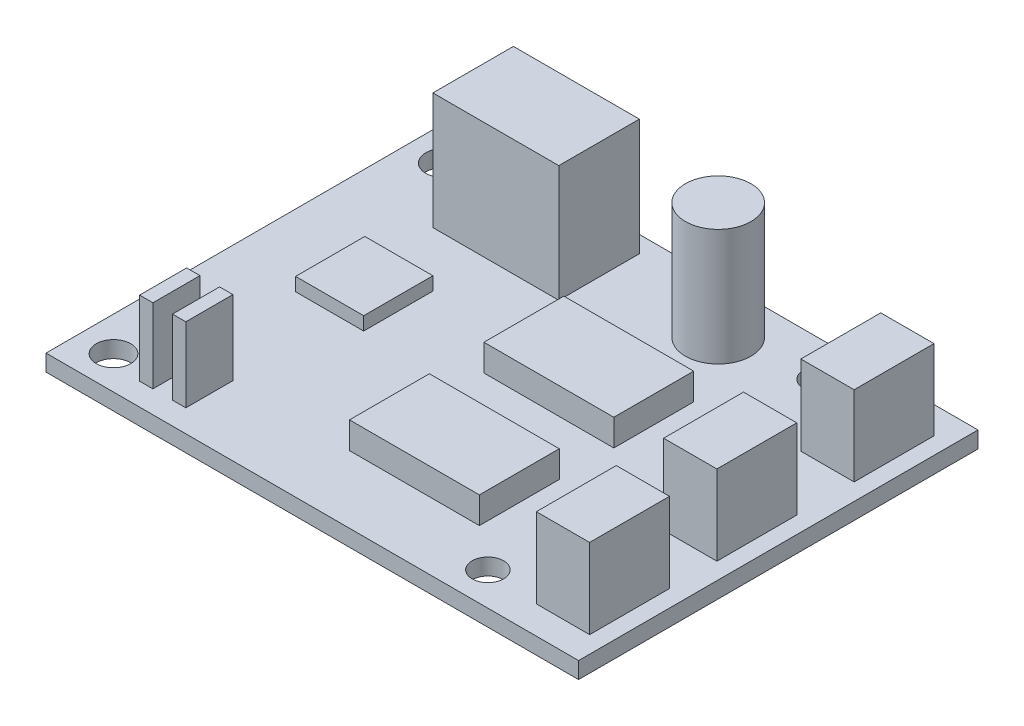
from build123d import *

# Parameters (mm, degrees)
SKETCH1_W           = 50.8
SKETCH1_H           = 38.1
BOSS_EXTRUDE1_DEPTH = 1.5748
SKETCH2_W           = 5.08
SKETCH2_H           = 7.62
BOSS_EXTRUDE2_DEPTH = 7.62
SKETCH3_R           = 3.127542457
SKETCH3_W           = 12.012072663
SKETCH3_H           = 7.683397829
BOSS_EXTRUDE3_DEPTH = 11.1252
SKETCH4_W           = 12.39083171
SKETCH4_H           = 7.62
BOSS_EXTRUDE4_DEPTH = 2.54
SKETCH5_W           = 6.49301225
SKETCH5_H           = 6.601229121
BOSS_EXTRUDE5_DEPTH = 1.27
SKETCH6_W           = 1.27
SKETCH6_H           = 4.49100014
BOSS_EXTRUDE6_DEPTH = 7.112
SKETCH7_R           = 1.645643818
SKETCH7_R_2         = 1.500472866
SKETCH7_R_3         = 1.42952807
SKETCH7_R_4         = 1.703993098
CUT_EXTRUDE1_DEPTH  = 7.112


with BuildPart() as part:
    # Sketch1 → Boss-Extrude1 (new body)
    with BuildSketch(Plane(origin=(0, 0, 0), x_dir=(1, 0, 0), z_dir=(0, 1, 0))):
        with Locations((25.4, 19.05)):
            Rectangle(SKETCH1_W, SKETCH1_H)
    extrude(amount=BOSS_EXTRUDE1_DEPTH)

    # Sketch2 → Boss-Extrude2 (add)
    with BuildSketch(Plane(origin=(0, 1.5748, 0), x_dir=(1, 0, 0), z_dir=(0, 1, 0))):
        with Locations((46.649948662, 6.474433462)):
            Rectangle(SKETCH2_W, SKETCH2_H)
        with Locations((46.649948662, 18.613569988)):
            Rectangle(SKETCH2_W, SKETCH2_H)
        with Locations((46.649948662, 31.703482685)):
            Rectangle(SKETCH2_W, SKETCH2_H)
    extrude(amount=BOSS_EXTRUDE2_DEPTH)

    # Sketch3 → Boss-Extrude3 (add)
    with BuildSketch(Plane(origin=(0, 1.5748, 0), x_dir=(1, 0, 0), z_dir=(0, 1, 0))):
        with Locations(Location((30.756735106, 33.361681168, 0), (0, 0, 90))):
            Circle(SKETCH3_R)
        with Locations((14.091336998, 32.658271508)):
            Rectangle(SKETCH3_W, SKETCH3_H)
    extrude(amount=BOSS_EXTRUDE3_DEPTH)

    # Sketch4 → Boss-Extrude4 (add)
    with BuildSketch(Plane(origin=(0, 1.5748, 0), x_dir=(1, 0, 0), z_dir=(0, 1, 0))):
        with Locations((28.727668778, 23.049379524)):
            Rectangle(SKETCH4_W, SKETCH4_H)
        with Locations((28.727668778, 10.22568033)):
            Rectangle(SKETCH4_W, SKETCH4_H)
    extrude(amount=BOSS_EXTRUDE4_DEPTH)

    # Sketch5 → Boss-Extrude5 (add)
    with BuildSketch(Plane(origin=(0, 1.5748, 0), x_dir=(1, 0, 0), z_dir=(0, 1, 0))):
        with Locations((10.087312777, 20.267439796)):
            Rectangle(SKETCH5_W, SKETCH5_H)
    extrude(amount=BOSS_EXTRUDE5_DEPTH)

    # Sketch6 → Boss-Extrude6 (add)
    with BuildSketch(Plane(origin=(0, 1.5748, 0), x_dir=(1, 0, 0), z_dir=(0, 1, 0))):
        with Locations((7.421698216, 4.386614002)):
            Rectangle(SKETCH6_W, SKETCH6_H)
        with Locations((10.559987471, 4.386614002)):
            Rectangle(SKETCH6_W, SKETCH6_H)
    extrude(amount=BOSS_EXTRUDE6_DEPTH)

    # Sketch7 → Cut-Extrude1 (cut)
    with BuildSketch(Plane(origin=(0, 1.5748, 0), x_dir=(1, 0, 0), z_dir=(0, 1, 0))):
        with Locations(Location((3.269649914, 3.169174205, 0), (0, 0, 270))):
            Circle(SKETCH7_R)
        with Locations(Location((38.98121729, 3.169174205, 0), (0, 0, 270))):
            Circle(SKETCH7_R_2)
        with Locations(Location((38.98121729, 34.660283618, 0), (0, 0, 270))):
            Circle(SKETCH7_R_3)
        with Locations(Location((3.269649914, 34.660283618, 0), (0, 0, 270))):
            Circle(SKETCH7_R_4)
    extrude(amount=-CUT_EXTRUDE1_DEPTH, mode=Mode.SUBTRACT)


solid = part.part
